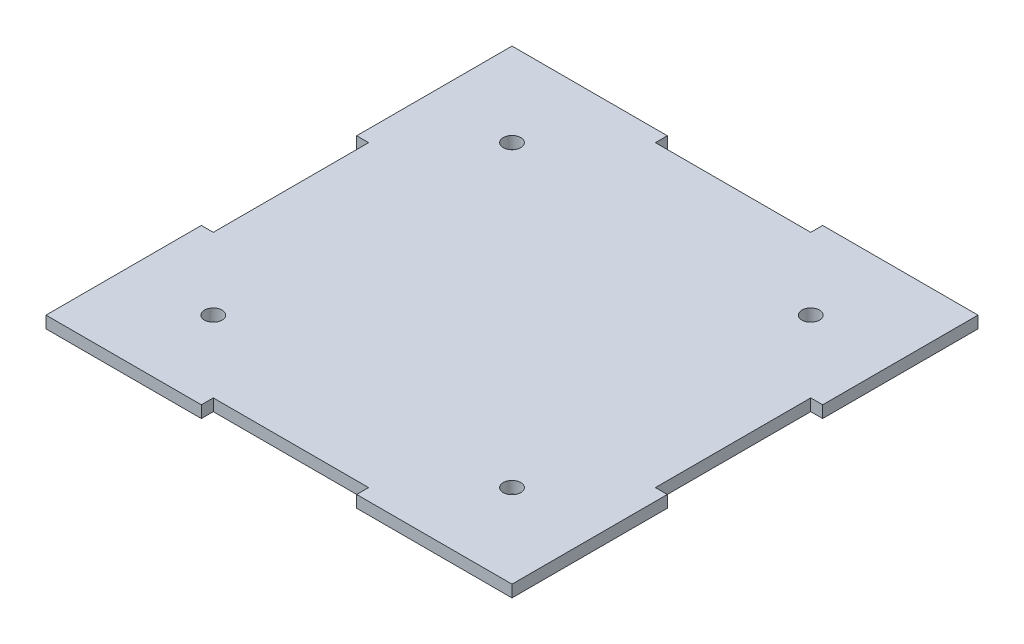
from build123d import *

# Parameters (mm, degrees)
SKETCH1_R           = 2.2
BOSS_EXTRUDE1_DEPTH = 3


with BuildPart() as part:
    # Sketch1 → Boss-Extrude1 (new body)
    with BuildSketch(Plane(origin=(0, 0, 0), x_dir=(1, 0, 0), z_dir=(0, 1, 0))):
        Polygon((-58.5, 19.5), (-58.5, 58.5), (-19.5, 58.5), (-19.5, 55.5), (19.5, 55.5), (19.5, 58.5), (58.5, 58.5), (58.5, 19.5), (55.5, 19.5), (55.5, -19.5), (58.5, -19.5), (58.5, -58.5), (19.5, -58.5), (19.5, -55.5), (-19.5, -55.5), (-19.5, -58.5), (-58.5, -58.5), (-58.5, -19.5), (-55.5, -19.5), (-55.5, 19.5), align=None)
        with Locations(Location((-37.5, 37.5, 0), (0, 0, 270))):
            Circle(SKETCH1_R, mode=Mode.SUBTRACT)
        with Locations(Location((37.5, 37.5, 0), (0, 0, 270))):
            Circle(SKETCH1_R, mode=Mode.SUBTRACT)
        with Locations(Location((37.5, -37.5, 0), (0, 0, 270))):
            Circle(SKETCH1_R, mode=Mode.SUBTRACT)
        with Locations(Location((-37.5, -37.5, 0), (0, 0, 270))):
            Circle(SKETCH1_R, mode=Mode.SUBTRACT)
    extrude(amount=BOSS_EXTRUDE1_DEPTH)


solid = part.part
